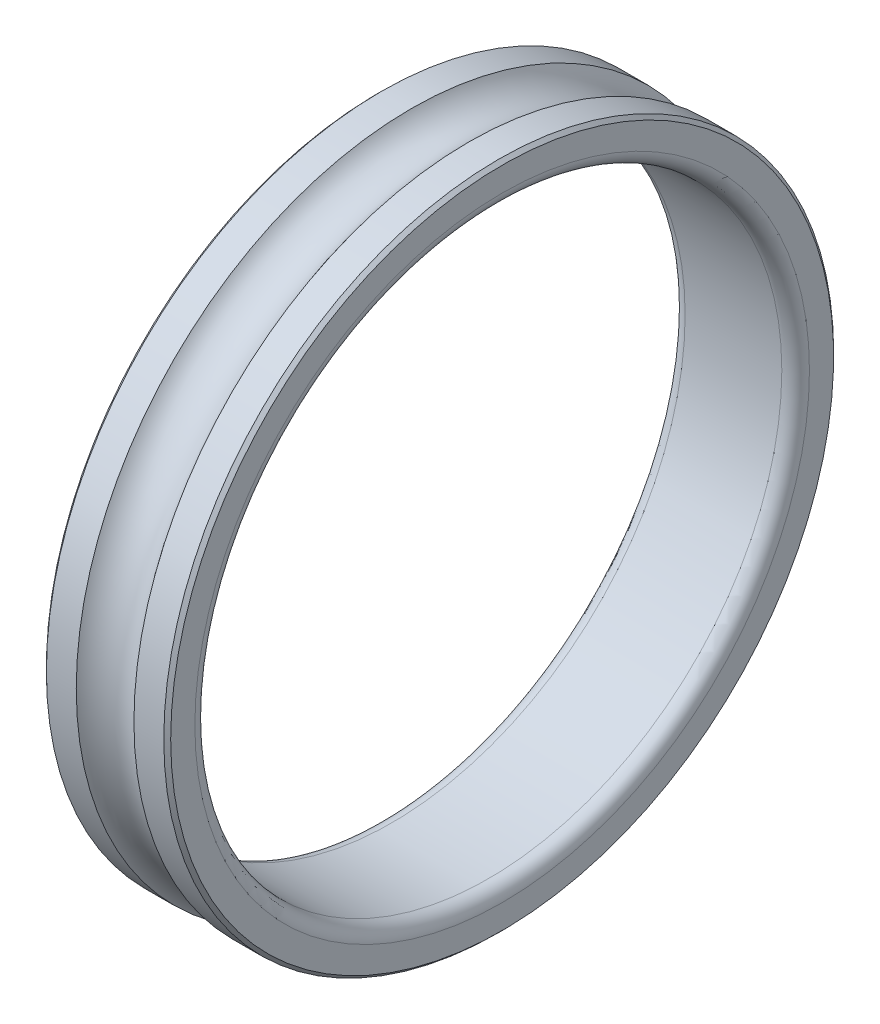
from build123d import *

# Parameters (mm, degrees)
CHANFREIN2_SIZE = 0.5


with BuildPart() as part:
    # Esquisse1 → Base-Révolution (revolve)
    with BuildSketch(Plane.XY, mode=Mode.PRIVATE) as base_r_volution_sk:
        with BuildLine():
            Line((2, 42.5), (16, 42.5))
            ThreePointArc((16, 42.5), (17.414213562, 43.085786438), (18, 44.5))
            Line((18, 44.5), (18, 48.5))
            Line((18, 48.5), (13.175823272, 48.5))
            ThreePointArc((13.175823272, 48.5), (9, 46.25), (4.824176728, 48.5))
            Line((4.824176728, 48.5), (0, 48.5))
            Line((0, 48.5), (0, 44.5))
            ThreePointArc((0, 44.5), (0.585786438, 43.085786438), (2, 42.5))
        make_face()
    revolve(base_r_volution_sk.sketch.rotate(Axis((0, 0, 0), (1, 0, 0)), 90), axis=Axis((0, 0, 0), (1, 0, 0)))

    # Chanfrein2
    chanfrein2_edges = [part.edges().sort_by_distance(p)[0] for p in [
        (18, 0, -48.5),
        (0, 0, -48.5),
    ]]
    chamfer(chanfrein2_edges, length=CHANFREIN2_SIZE)


solid = part.part
